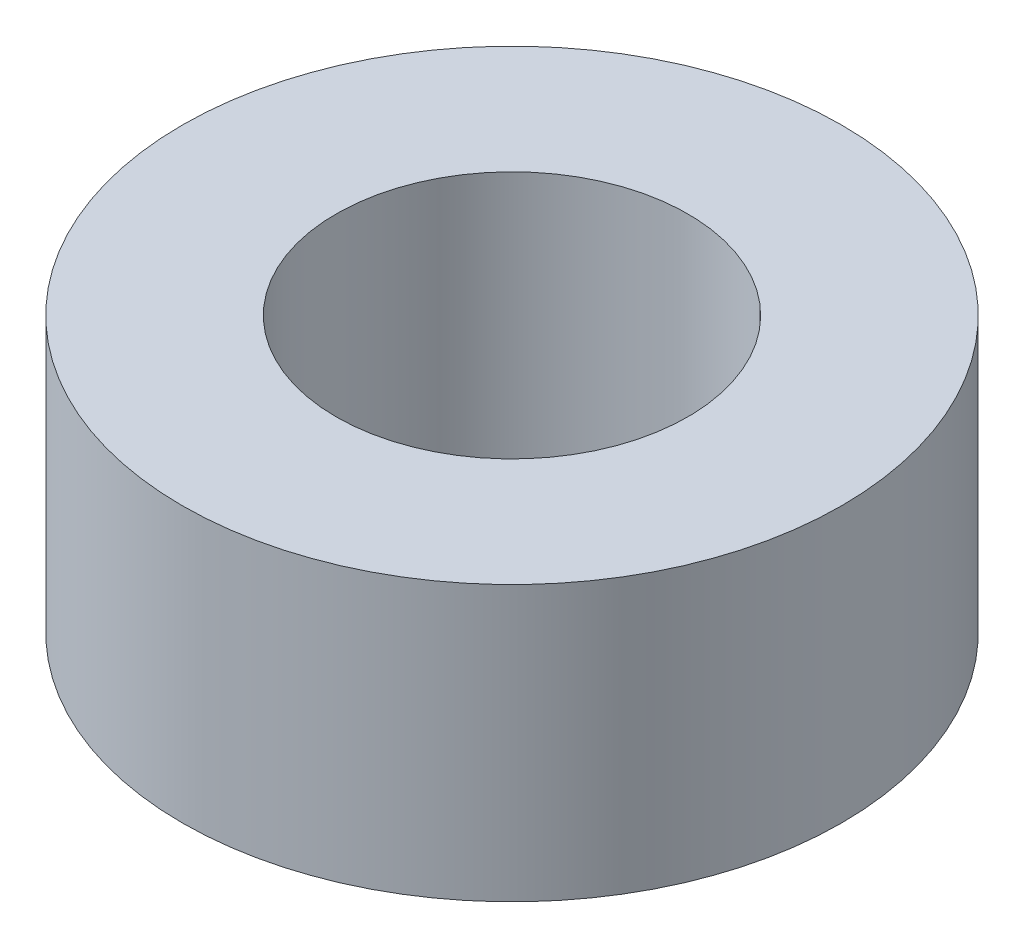
from build123d import *

# Parameters (mm, degrees)
SKETCH1_R           = 3
SKETCH1_R_2         = 1.6
BOSS_EXTRUDE1_DEPTH = 2.5


with BuildPart() as part:
    # Sketch1 → Boss-Extrude1 (new body)
    with BuildSketch(Plane(origin=(0, 0, 0), x_dir=(1, 0, 0), z_dir=(0, 1, 0))):
        with Locations(Location((0, 0, 0), (0, 0, 270))):
            Circle(SKETCH1_R)
        with Locations(Location((0, 0, 0), (0, 0, 270))):
            Circle(SKETCH1_R_2, mode=Mode.SUBTRACT)
    extrude(amount=BOSS_EXTRUDE1_DEPTH)


solid = part.part
